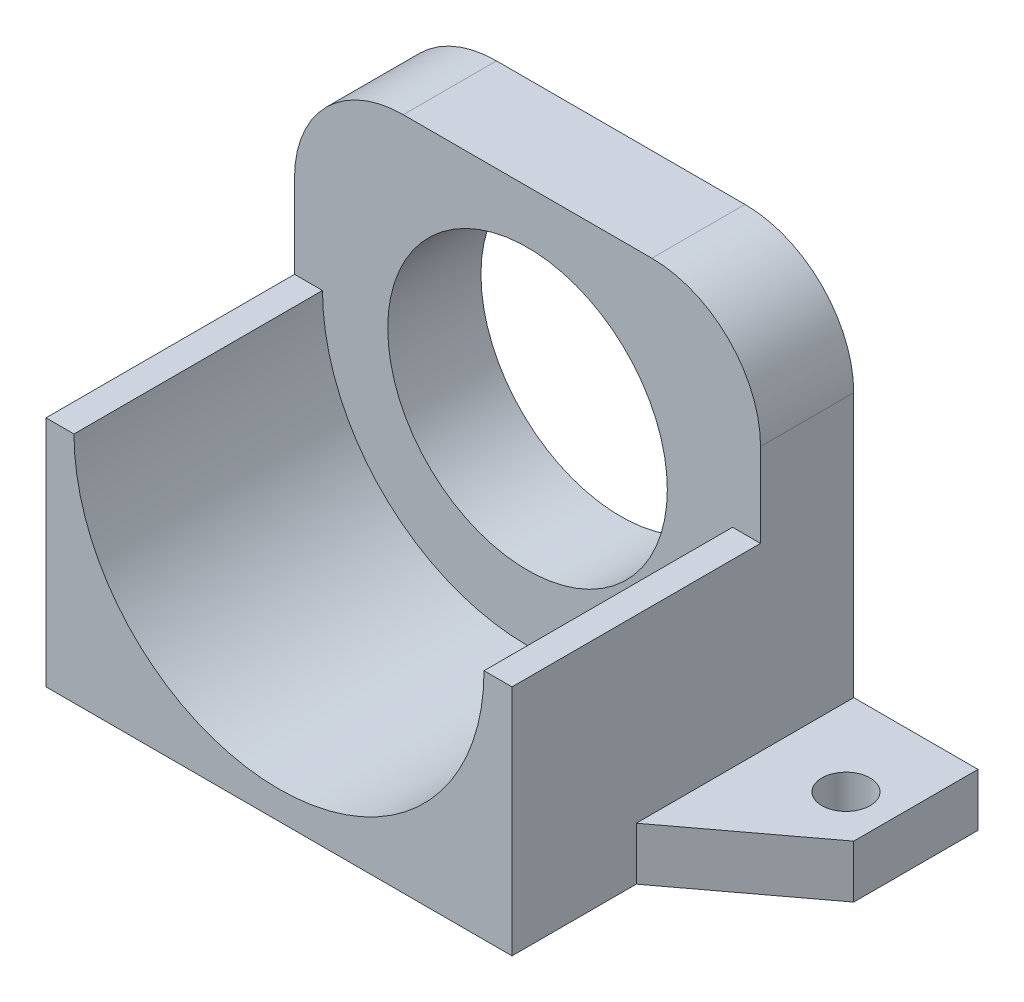
from build123d import *

# Parameters (mm, degrees)
BOSS_EXTRUDE1_DEPTH = 6
SKETCH2_R           = 9
CUT_EXTRUDE1_DEPTH  = 6
FILLET1_R           = 7
BOSS_EXTRUDE2_DEPTH = 16
SKETCH5_W           = 8
SKETCH5_H           = 3.4
BOSS_EXTRUDE3_DEPTH = 2
SKETCH6_R           = 1.55
CUT_EXTRUDE3_DEPTH  = 40.862262856
BOSS_EXTRUDE5_DEPTH = 3.4


with BuildPart() as part:
    # Sketch1 → Boss-Extrude1 (new body)
    with BuildSketch(Plane.XY):
        Polygon((-23, 0), (23, 0), (23, 3.4), (15, 3.4), (15, 27.4), (-15, 27.4), (-15, 3.4), (-23, 3.4), align=None)
    extrude(amount=BOSS_EXTRUDE1_DEPTH)

    # Sketch2 → Cut-Extrude1 (cut)
    with BuildSketch(Plane(origin=(0, 0, 0), x_dir=(-1, 0, 0), z_dir=(0, 0, -1))):
        with Locations((0, 15)):
            Circle(SKETCH2_R)
    extrude(amount=-CUT_EXTRUDE1_DEPTH, mode=Mode.SUBTRACT)

    # Fillet1
    fillet1_edges = [part.edges().sort_by_distance(p)[0] for p in [
        (-15, 27.4, 3),
        (15, 27.4, 3),
    ]]
    fillet(fillet1_edges, radius=FILLET1_R)

    # Sketch4 → Boss-Extrude2 (add)
    with BuildSketch(Plane.XY.offset(6)):
        with BuildLine():
            Line((-15, 0), (15, 0))
            Line((15, 0), (15, 15))
            Line((15, 15), (13.2, 15))
            ThreePointArc((13.2, 15), (0, 1.8), (-13.2, 15))
            Line((-13.2, 15), (-15, 15))
            Line((-15, 15), (-15, 0))
        make_face()
    extrude(amount=BOSS_EXTRUDE2_DEPTH)

    # Sketch5 → Boss-Extrude3 (add)
    with BuildSketch(Plane.XY.offset(6)):
        with Locations((-19, 1.7)):
            Rectangle(SKETCH5_W, SKETCH5_H)
        with Locations((19, 1.7)):
            Rectangle(SKETCH5_W, SKETCH5_H)
    extrude(amount=BOSS_EXTRUDE3_DEPTH)

    # Sketch6 → Cut-Extrude3 (cut, through all)
    with BuildSketch(Plane(origin=(0, 3.4, 0), x_dir=(1, 0, 0), z_dir=(0, 1, 0))):
        with Locations(Location((20, -5.5, 0), (0, 0, 270))):
            Circle(SKETCH6_R)
        with Locations(Location((-20, -5.5, 0), (0, 0, 270))):
            Circle(SKETCH6_R)
    extrude(amount=-CUT_EXTRUDE3_DEPTH, mode=Mode.SUBTRACT)

    # Sketch8 → Boss-Extrude5 (add)
    with BuildSketch(Plane(origin=(0, 0, 0), x_dir=(1, 0, 0), z_dir=(0, 1, 0))):
        Polygon((-23, -8), (-15, -14), (-15, -8), align=None)
        Polygon((15, -14), (23, -8), (15, -8), align=None)
    extrude(amount=BOSS_EXTRUDE5_DEPTH)


solid = part.part
